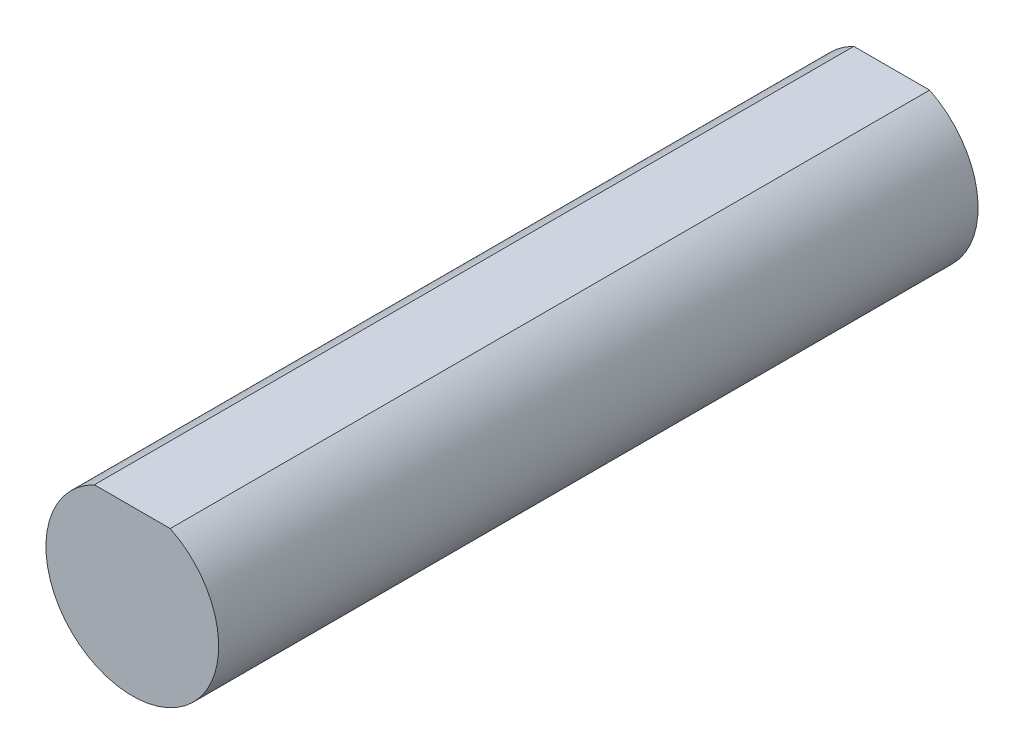
from build123d import *

# Parameters (mm, degrees)
SKETCH1_R           = 2.5019
BOSS_EXTRUDE1_DEPTH = 21.9964
CUT_EXTRUDE1_START  = -21.9964
CUT_EXTRUDE1_DEPTH  = 21.9964


with BuildPart() as part:
    # Sketch1 → Boss-Extrude1 (new body)
    with BuildSketch(Plane.XY):
        Circle(SKETCH1_R)
    extrude(amount=BOSS_EXTRUDE1_DEPTH)

    # Sketch3 → Cut-Extrude1 (cut)
    with BuildSketch(Plane.XY.offset(21.9964).offset(CUT_EXTRUDE1_START)):
        with BuildLine():
            Line((-1.098384814, 2.2479), (1.098384814, 2.2479))
            ThreePointArc((1.098384814, 2.2479), (0, 2.5019), (-1.098384814, 2.2479))
        make_face()
    extrude(amount=CUT_EXTRUDE1_DEPTH, mode=Mode.SUBTRACT)


solid = part.part
